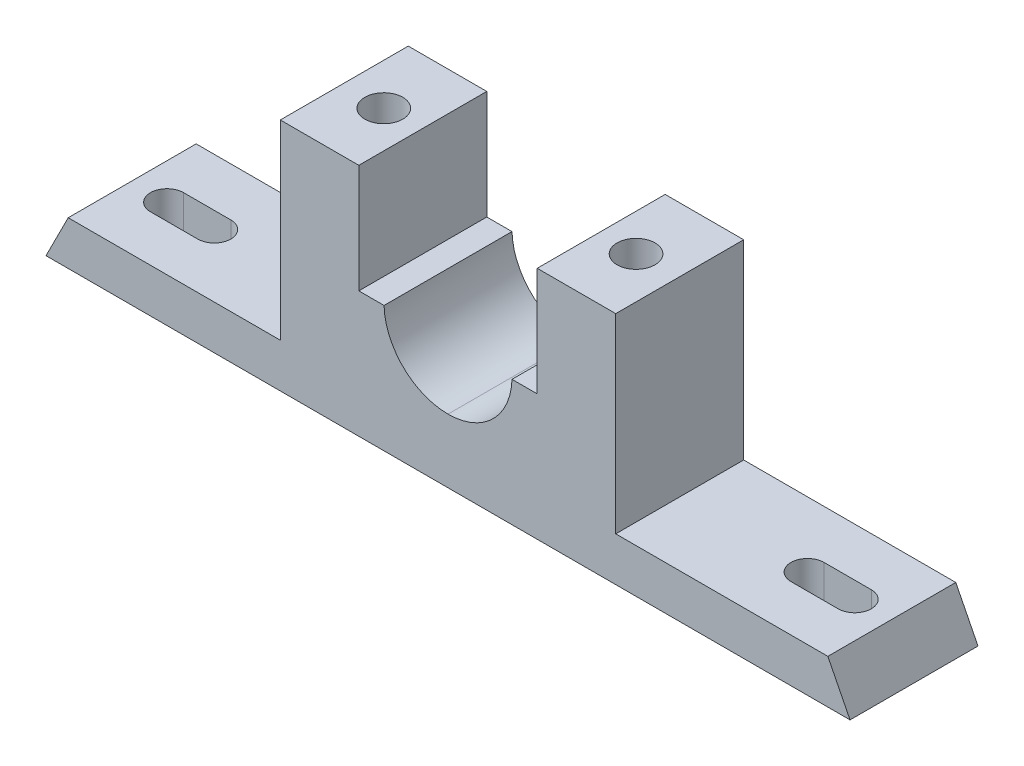
from build123d import *

# Parameters (mm, degrees)
BOSS_EXTRUDE1_DEPTH = 64
CUT_EXTRUDE1_DEPTH  = 64


with BuildPart() as part:
    # Sketch1 → Boss-Extrude1 (new body)
    with BuildSketch(Plane.XY):
        with BuildLine():
            Line((-201.08411215, 0), (-189.981308411, 22))
            Line((-189.981308411, 22), (-83.887850467, 22))
            Line((-83.887850467, 22), (-83.887850467, 117.401869159))
            Line((-83.887850467, 117.401869159), (-44.613332129, 117.401869159))
            Line((-44.613332129, 117.401869159), (-44.613332129, 63))
            Line((-44.613332129, 63), (-32, 63))
            ThreePointArc((-32, 63), (-22.308799202, 40.963993281), (0, 31.918417389))
            ThreePointArc((0, 31.918417389), (22.308799202, 40.963993281), (32, 63))
            Line((32, 63), (44.613332129, 63))
            Line((44.613332129, 63), (44.613332129, 117.401869159))
            Line((44.613332129, 117.401869159), (83.887850467, 117.401869159))
            Line((83.887850467, 117.401869159), (83.887850467, 22))
            Line((83.887850467, 22), (189.981308411, 22))
            Line((189.981308411, 22), (201.08411215, 0))
            Line((201.08411215, 0), (-201.08411215, 0))
        make_face()
    extrude(amount=BOSS_EXTRUDE1_DEPTH)

    # Sketch2 → Cut-Extrude1 (cut)
    with BuildSketch(Plane(origin=(0, 22, 0), x_dir=(1, 0, 0), z_dir=(0, 1, 0))):
        with BuildLine():
            Line((-171.985857657, -24.273514292), (-148.363703714, -24.273514292))
            ThreePointArc((-148.363703714, -24.273514292), (-140.075228646, -32.56198936), (-148.363703714, -40.850464428))
            Line((-148.363703714, -40.850464428), (-171.985857657, -40.850464428))
            ThreePointArc((-171.985857657, -40.850464428), (-180.274332725, -32.56198936), (-171.985857657, -24.273514292))
        make_face()
    cut_extrude1 = extrude(amount=-CUT_EXTRUDE1_DEPTH, mode=Mode.SUBTRACT)

    # Sketch5 → CBORE for M5 Hex Head Bolt1 (revolve, cut)
    with BuildSketch(Plane(origin=(-63.08411215, 0, 33.036059383), x_dir=(0, 0, -1), z_dir=(1, 0, 0))):
        Polygon((0, 0), (0, 135.708175881), (9.5, 130), (9.5, 12), (15, 12), (15, 0), align=None)
    cbore_for_m5_hex_head_bolt1 = revolve(axis=Axis((-63.08411215, -6.35, 33.036059383), (0, 1, 0)), mode=Mode.SUBTRACT)

    # Mirror1: Cut-Extrude1, CBORE for M5 Hex Head Bolt1 across plane
    add(cut_extrude1.mirror(Plane(origin=(0, 0, 0), x_dir=(0, 0, 1), z_dir=(1, 0, 0))), mode=Mode.SUBTRACT)
    add(cbore_for_m5_hex_head_bolt1.mirror(Plane(origin=(0, 0, 0), x_dir=(0, 0, 1), z_dir=(1, 0, 0))), mode=Mode.SUBTRACT)


solid = part.part
